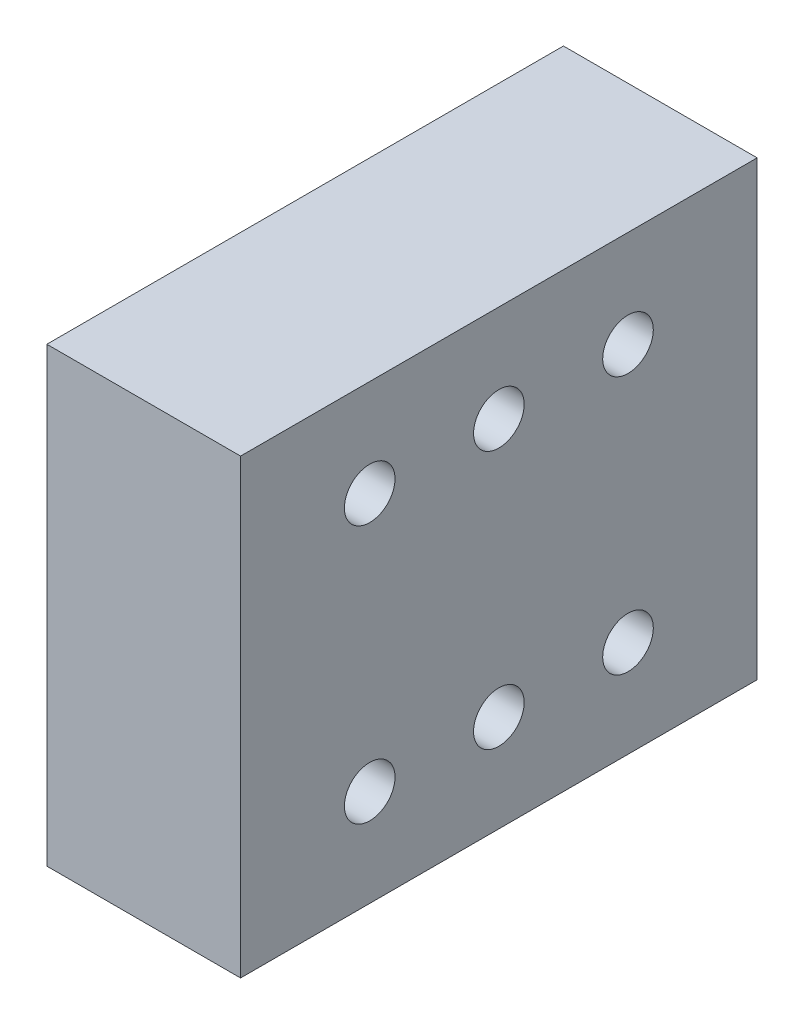
from build123d import *

# Parameters (mm, degrees)
SKETCH1_W           = 19.05
SKETCH1_H           = 44.45
BOSS_EXTRUDE1_DEPTH = 50.8
SKETCH2_R           = 2.4892
CUT_EXTRUDE1_DEPTH  = 71.138042459


with BuildPart() as part:
    # Sketch1 → Boss-Extrude1 (new body)
    with BuildSketch(Plane.XY):
        with Locations((9.525, 22.225)):
            Rectangle(SKETCH1_W, SKETCH1_H)
    extrude(amount=BOSS_EXTRUDE1_DEPTH)

    # Sketch2 → Cut-Extrude1 (cut, through all)
    with BuildSketch(Plane(origin=(19.05, 0, 0), x_dir=(0, 0, -1), z_dir=(1, 0, 0))):
        with Locations(Location((-38.1, 9.525, 0), (0, 0, 90))):
            Circle(SKETCH2_R)
        with Locations(Location((-25.4, 9.525, 0), (0, 0, 90))):
            Circle(SKETCH2_R)
        with Locations(Location((-12.7, 9.525, 0), (0, 0, 90))):
            Circle(SKETCH2_R)
        with Locations(Location((-38.1, 34.925, 0), (0, 0, 90))):
            Circle(SKETCH2_R)
        with Locations(Location((-25.4, 34.925, 0), (0, 0, 90))):
            Circle(SKETCH2_R)
        with Locations(Location((-12.7, 34.925, 0), (0, 0, 90))):
            Circle(SKETCH2_R)
    extrude(amount=-CUT_EXTRUDE1_DEPTH, mode=Mode.SUBTRACT)


solid = part.part
